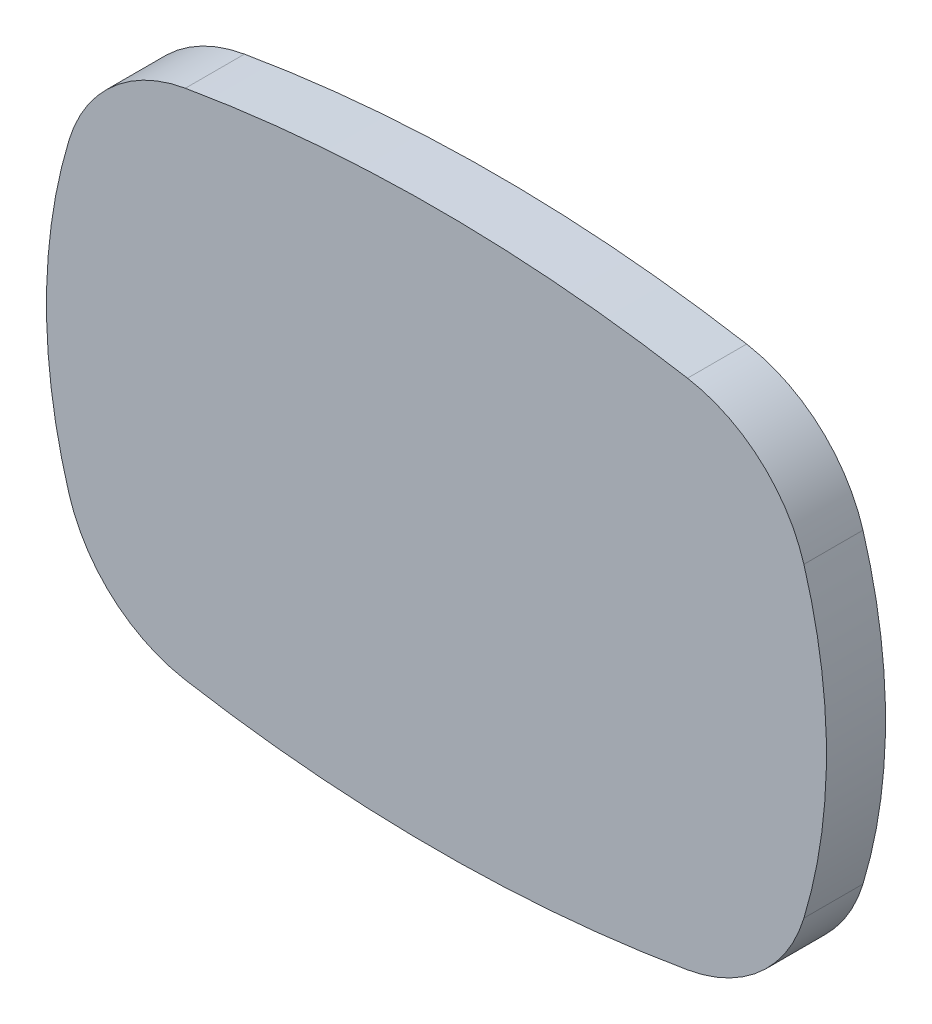
from build123d import *

# Parameters (mm, degrees)
EXTRUDE_1_DEPTH = 10


with BuildPart() as part:
    # 草圖1 → 填料-伸長1 (new body)
    with BuildSketch(Plane.XY):
        with BuildLine():
            ThreePointArc((62.18427331, 57.928189948), (54.816661128, 69.443645745), (42.493552656, 75.362127736))
            ThreePointArc((42.493552656, 75.362127736), (0, 79), (-42.493552656, 75.362127736))
            ThreePointArc((-42.493552656, 75.362127736), (-54.816661128, 69.443645745), (-62.18427331, 57.928189948))
            ThreePointArc((-62.18427331, 57.928189948), (-66, 32), (-62.18427331, 6.071810052))
            ThreePointArc((-62.18427331, 6.071810052), (-54.816661128, -5.443645745), (-42.493552656, -11.362127736))
            ThreePointArc((-42.493552656, -11.362127736), (0, -15), (42.493552656, -11.362127736))
            ThreePointArc((42.493552656, -11.362127736), (54.816661128, -5.443645745), (62.18427331, 6.071810052))
            ThreePointArc((62.18427331, 6.071810052), (66, 32), (62.18427331, 57.928189948))
        make_face()
    extrude(amount=EXTRUDE_1_DEPTH)


solid = part.part
